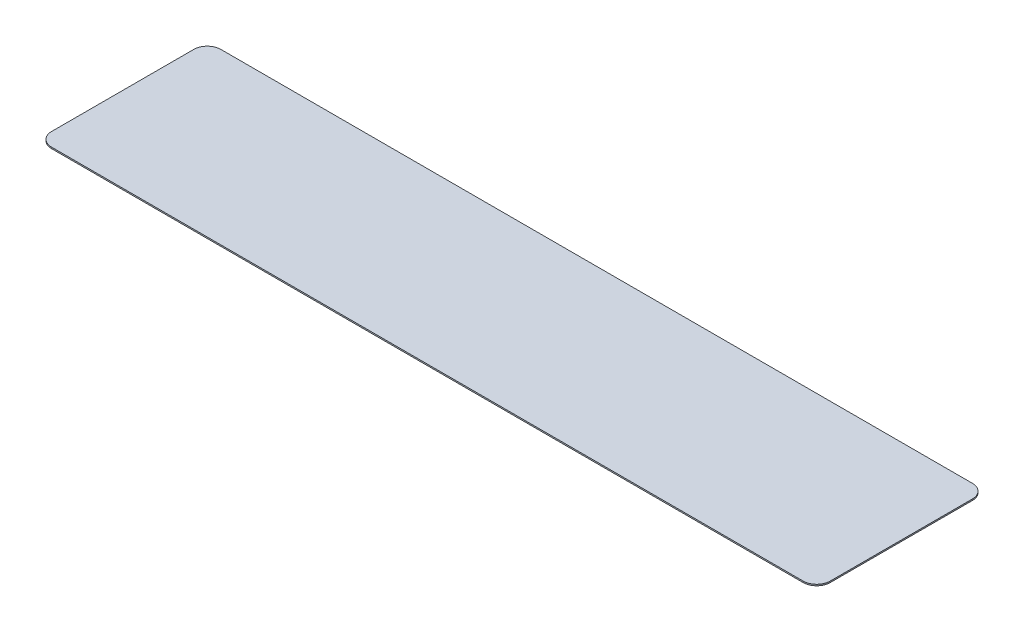
from build123d import *

# Parameters (mm, degrees)
BOSS_EXTRUDE1_DEPTH = 0.4


with BuildPart() as part:
    # Sketch2 → Boss-Extrude1 (new body)
    with BuildSketch(Plane(origin=(0, 0, 0), x_dir=(1, 0, 0), z_dir=(0, 1, 0))):
        with BuildLine():
            Line((-147.5, -3.324324324), (74.5, -3.324324324))
            ThreePointArc((74.5, -3.324324324), (77.328427125, -2.152751449), (78.5, 0.675675676))
            Line((78.5, 0.675675676), (78.5, 42.675675676))
            ThreePointArc((78.5, 42.675675676), (77.328427125, 45.5041028), (74.5, 46.675675676))
            Line((74.5, 46.675675676), (-147.5, 46.675675676))
            ThreePointArc((-147.5, 46.675675676), (-150.328427125, 45.5041028), (-151.5, 42.675675676))
            Line((-151.5, 42.675675676), (-151.5, 0.675675676))
            ThreePointArc((-151.5, 0.675675676), (-150.328427125, -2.152751449), (-147.5, -3.324324324))
        make_face()
    extrude(amount=BOSS_EXTRUDE1_DEPTH)


solid = part.part
